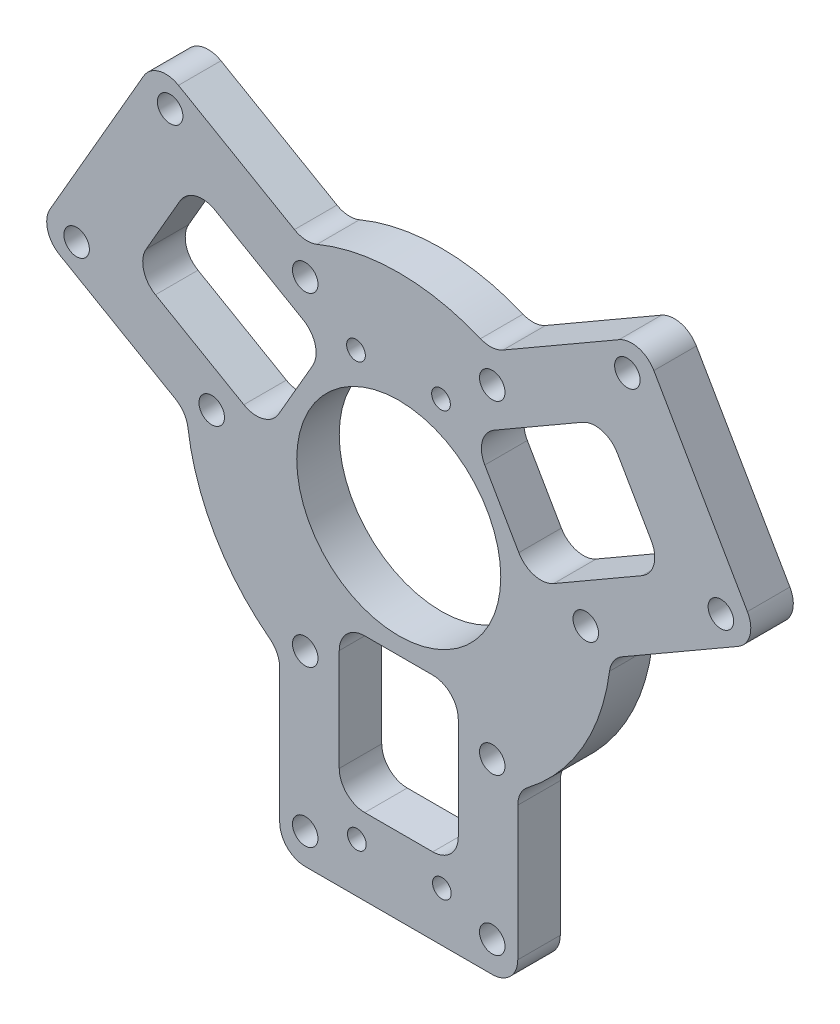
from build123d import *

# Parameters (mm, degrees)
SKETCH1_R           = 25
BOSS_EXTRUDE1_DEPTH = 5
CUT_EXTRUDE1_REACH  = 61.269
SKETCH2_R           = 1.5
FILLET1_R           = 3
CUT_EXTRUDE2_REACH  = 60.487
SKETCH3_R           = 1.1
CUT_EXTRUDE3_REACH  = 60.487
SKETCH4_R           = 1.5
FILLET2_R           = 3
CUT_EXTRUDE4_REACH  = 60.487
SKETCH5_R           = 12
SKETCH5_W           = 14
SKETCH5_H           = 18
FILLET3_R           = 3


with BuildPart() as part:
    # Sketch1 → Boss-Extrude1 (new body)
    with BuildSketch(Plane.XY):
        with BuildLine():
            ThreePointArc((-24.937391115, -1.768198064), (-21.650635095, 12.5), (-10.937391115, 22.480513242))
            Line((-10.937391115, 22.480513242), (-28.507041555, 32.624355653))
            Line((-28.507041555, 32.624355653), (-42.507041555, 8.375644347))
            Line((-42.507041555, 8.375644347), (-24.937391115, -1.768198064))
        make_face()
        Circle(SKETCH1_R)
        with BuildLine():
            Line((28.507041555, 32.624355653), (10.937391115, 22.480513242))
            ThreePointArc((10.937391115, 22.480513242), (21.194749089, 13.258303476), (25, 0))
            ThreePointArc((25, 0), (24.984342876, -0.884653077), (24.937391115, -1.768198064))
            Line((24.937391115, -1.768198064), (42.507041555, 8.375644347))
            Line((42.507041555, 8.375644347), (28.507041555, 32.624355653))
        make_face()
        with BuildLine():
            ThreePointArc((14, -20.712315177), (0, -25), (-14, -20.712315177))
            Line((-14, -20.712315177), (-14, -41))
            Line((-14, -41), (14, -41))
            Line((14, -41), (14, -20.712315177))
        make_face()
    extrude(amount=BOSS_EXTRUDE1_DEPTH)

    # Sketch2 → Cut-Extrude1 (cut, up to next)
    with BuildSketch(Plane.XY.offset(5), mode=Mode.PRIVATE) as cut_extrude1_sk1:
        with Locations((11, -37.4)):
            Circle(SKETCH2_R)
    cut_extrude1_tool1 = extrude(cut_extrude1_sk1.sketch, amount=-CUT_EXTRUDE1_REACH, mode=Mode.PRIVATE) & part.part
    # Sketch2 → Cut-Extrude1 (cut, up to next)
    with BuildSketch(Plane.XY.offset(5), mode=Mode.PRIVATE) as cut_extrude1_sk2:
        with Locations((-11, -37.4)):
            Circle(SKETCH2_R)
    cut_extrude1_tool2 = extrude(cut_extrude1_sk2.sketch, amount=-CUT_EXTRUDE1_REACH, mode=Mode.PRIVATE) & part.part
    # Sketch2 → Cut-Extrude1 (cut, up to next)
    with BuildSketch(Plane.XY.offset(5), mode=Mode.PRIVATE) as cut_extrude1_sk3:
        with Locations((-37.889350102, 9.173720558)):
            Circle(SKETCH2_R)
    cut_extrude1_tool3 = extrude(cut_extrude1_sk3.sketch, amount=-CUT_EXTRUDE1_REACH, mode=Mode.PRIVATE) & part.part
    # Sketch2 → Cut-Extrude1 (cut, up to next)
    with BuildSketch(Plane.XY.offset(5), mode=Mode.PRIVATE) as cut_extrude1_sk4:
        with Locations((-26.889350102, 28.226279442)):
            Circle(SKETCH2_R)
    cut_extrude1_tool4 = extrude(cut_extrude1_sk4.sketch, amount=-CUT_EXTRUDE1_REACH, mode=Mode.PRIVATE) & part.part
    # Sketch2 → Cut-Extrude1 (cut, up to next)
    with BuildSketch(Plane.XY.offset(5), mode=Mode.PRIVATE) as cut_extrude1_sk5:
        with Locations((26.889350102, 28.226279442)):
            Circle(SKETCH2_R)
    cut_extrude1_tool5 = extrude(cut_extrude1_sk5.sketch, amount=-CUT_EXTRUDE1_REACH, mode=Mode.PRIVATE) & part.part
    # Sketch2 → Cut-Extrude1 (cut, up to next)
    with BuildSketch(Plane.XY.offset(5), mode=Mode.PRIVATE) as cut_extrude1_sk6:
        with Locations((37.889350102, 9.173720558)):
            Circle(SKETCH2_R)
    cut_extrude1_tool6 = extrude(cut_extrude1_sk6.sketch, amount=-CUT_EXTRUDE1_REACH, mode=Mode.PRIVATE) & part.part
    add(cut_extrude1_tool1.solids().sort_by_distance((11, -37.4, 5))[0], mode=Mode.SUBTRACT)
    add(cut_extrude1_tool2.solids().sort_by_distance((-11, -37.4, 5))[0], mode=Mode.SUBTRACT)
    add(cut_extrude1_tool3.solids().sort_by_distance((-37.88935, 9.173721, 5))[0], mode=Mode.SUBTRACT)
    add(cut_extrude1_tool4.solids().sort_by_distance((-26.88935, 28.226279, 5))[0], mode=Mode.SUBTRACT)
    add(cut_extrude1_tool5.solids().sort_by_distance((26.88935, 28.226279, 5))[0], mode=Mode.SUBTRACT)
    add(cut_extrude1_tool6.solids().sort_by_distance((37.88935, 9.173721, 5))[0], mode=Mode.SUBTRACT)

    # Fillet1
    fillet1_edges = [part.edges().sort_by_distance(p)[0] for p in [
        (-42.507041555, 8.375644347, 2.5),
        (-28.507041555, 32.624355653, 2.5),
        (28.507041555, 32.624355653, 2.5),
        (42.507041555, 8.375644347, 2.5),
        (14, -41, 2.5),
        (-14, -41, 2.5),
    ]]
    fillet(fillet1_edges, radius=FILLET1_R)

    # Sketch3 → Cut-Extrude2 (cut, up to next)
    with BuildSketch(Plane(origin=(0, 0, 0), x_dir=(-1, 0, 0), z_dir=(0, 0, -1)), mode=Mode.PRIVATE) as cut_extrude2_sk1:
        with Locations((5.030631655, 14.595653448)):
            Circle(SKETCH3_R)
    cut_extrude2_tool1 = extrude(cut_extrude2_sk1.sketch, amount=-CUT_EXTRUDE2_REACH, mode=Mode.PRIVATE) & part.part
    # Sketch3 → Cut-Extrude2 (cut, up to next)
    with BuildSketch(Plane(origin=(0, 0, 0), x_dir=(-1, 0, 0), z_dir=(0, 0, -1)), mode=Mode.PRIVATE) as cut_extrude2_sk2:
        with Locations((-4.969346288, 14.61665653)):
            Circle(SKETCH3_R)
    cut_extrude2_tool2 = extrude(cut_extrude2_sk2.sketch, amount=-CUT_EXTRUDE2_REACH, mode=Mode.PRIVATE) & part.part
    # Sketch3 → Cut-Extrude2 (cut, up to next)
    with BuildSketch(Plane(origin=(0, 0, 0), x_dir=(-1, 0, 0), z_dir=(0, 0, -1)), mode=Mode.PRIVATE) as cut_extrude2_sk3:
        with Locations((4.926079941, -35.183463358)):
            Circle(SKETCH3_R)
    cut_extrude2_tool3 = extrude(cut_extrude2_sk3.sketch, amount=-CUT_EXTRUDE2_REACH, mode=Mode.PRIVATE) & part.part
    # Sketch3 → Cut-Extrude2 (cut, up to next)
    with BuildSketch(Plane(origin=(0, 0, 0), x_dir=(-1, 0, 0), z_dir=(0, 0, -1)), mode=Mode.PRIVATE) as cut_extrude2_sk4:
        with Locations((-5.073898003, -35.162460277)):
            Circle(SKETCH3_R)
    cut_extrude2_tool4 = extrude(cut_extrude2_sk4.sketch, amount=-CUT_EXTRUDE2_REACH, mode=Mode.PRIVATE) & part.part
    add(cut_extrude2_tool1.solids().sort_by_distance((-5.030632, 14.595653, 0))[0], mode=Mode.SUBTRACT)
    add(cut_extrude2_tool2.solids().sort_by_distance((4.969346, 14.616657, 0))[0], mode=Mode.SUBTRACT)
    add(cut_extrude2_tool3.solids().sort_by_distance((-4.92608, -35.183463, 0))[0], mode=Mode.SUBTRACT)
    add(cut_extrude2_tool4.solids().sort_by_distance((5.073898, -35.16246, 0))[0], mode=Mode.SUBTRACT)

    # Sketch4 → Cut-Extrude3 (cut, up to next)
    with BuildSketch(Plane.XY.offset(5), mode=Mode.PRIVATE) as cut_extrude3_sk1:
        with Locations((22, 0)):
            Circle(SKETCH4_R)
    cut_extrude3_tool1 = extrude(cut_extrude3_sk1.sketch, amount=-CUT_EXTRUDE3_REACH, mode=Mode.PRIVATE) & part.part
    # Sketch4 → Cut-Extrude3 (cut, up to next)
    with BuildSketch(Plane.XY.offset(5), mode=Mode.PRIVATE) as cut_extrude3_sk2:
        with Locations((11, -19.052558883)):
            Circle(SKETCH4_R)
    cut_extrude3_tool2 = extrude(cut_extrude3_sk2.sketch, amount=-CUT_EXTRUDE3_REACH, mode=Mode.PRIVATE) & part.part
    # Sketch4 → Cut-Extrude3 (cut, up to next)
    with BuildSketch(Plane.XY.offset(5), mode=Mode.PRIVATE) as cut_extrude3_sk3:
        with Locations((-11, -19.052558883)):
            Circle(SKETCH4_R)
    cut_extrude3_tool3 = extrude(cut_extrude3_sk3.sketch, amount=-CUT_EXTRUDE3_REACH, mode=Mode.PRIVATE) & part.part
    # Sketch4 → Cut-Extrude3 (cut, up to next)
    with BuildSketch(Plane.XY.offset(5), mode=Mode.PRIVATE) as cut_extrude3_sk4:
        with Locations((-22, 0)):
            Circle(SKETCH4_R)
    cut_extrude3_tool4 = extrude(cut_extrude3_sk4.sketch, amount=-CUT_EXTRUDE3_REACH, mode=Mode.PRIVATE) & part.part
    # Sketch4 → Cut-Extrude3 (cut, up to next)
    with BuildSketch(Plane.XY.offset(5), mode=Mode.PRIVATE) as cut_extrude3_sk5:
        with Locations((-11, 19.052558883)):
            Circle(SKETCH4_R)
    cut_extrude3_tool5 = extrude(cut_extrude3_sk5.sketch, amount=-CUT_EXTRUDE3_REACH, mode=Mode.PRIVATE) & part.part
    # Sketch4 → Cut-Extrude3 (cut, up to next)
    with BuildSketch(Plane.XY.offset(5), mode=Mode.PRIVATE) as cut_extrude3_sk6:
        with Locations((11, 19.052558883)):
            Circle(SKETCH4_R)
    cut_extrude3_tool6 = extrude(cut_extrude3_sk6.sketch, amount=-CUT_EXTRUDE3_REACH, mode=Mode.PRIVATE) & part.part
    add(cut_extrude3_tool1.solids().sort_by_distance((22, 0, 5))[0], mode=Mode.SUBTRACT)
    add(cut_extrude3_tool2.solids().sort_by_distance((11, -19.052559, 5))[0], mode=Mode.SUBTRACT)
    add(cut_extrude3_tool3.solids().sort_by_distance((-11, -19.052559, 5))[0], mode=Mode.SUBTRACT)
    add(cut_extrude3_tool4.solids().sort_by_distance((-22, 0, 5))[0], mode=Mode.SUBTRACT)
    add(cut_extrude3_tool5.solids().sort_by_distance((-11, 19.052559, 5))[0], mode=Mode.SUBTRACT)
    add(cut_extrude3_tool6.solids().sort_by_distance((11, 19.052559, 5))[0], mode=Mode.SUBTRACT)

    # Fillet2
    fillet2_edges = [part.edges().sort_by_distance(p)[0] for p in [
        (-10.937391115, 22.480513242, 2.5),
        (10.937391115, 22.480513242, 2.5),
        (24.937391115, -1.768198064, 2.5),
        (14, -20.712315177, 2.5),
        (-14, -20.712315177, 2.5),
        (-24.937391115, -1.768198064, 2.5),
    ]]
    fillet(fillet2_edges, radius=FILLET2_R)

    # Sketch5 → Cut-Extrude4 (cut, up to next)
    with BuildSketch(Plane.XY.offset(5), mode=Mode.PRIVATE) as cut_extrude4_sk1:
        Circle(SKETCH5_R)
    cut_extrude4_tool1 = extrude(cut_extrude4_sk1.sketch, amount=-CUT_EXTRUDE4_REACH, mode=Mode.PRIVATE) & part.part
    # Sketch5 → Cut-Extrude4 (cut, up to next)
    with BuildSketch(Plane.XY.offset(5), mode=Mode.PRIVATE) as cut_extrude4_sk2:
        Polygon((-8.624355653, 13.062177826), (-15.624355653, 0.937822174), (-31.212812921, 9.937822174), (-24.212812921, 22.062177826), align=None)
    cut_extrude4_tool2 = extrude(cut_extrude4_sk2.sketch, amount=-CUT_EXTRUDE4_REACH, mode=Mode.PRIVATE) & part.part
    # Sketch5 → Cut-Extrude4 (cut, up to next)
    with BuildSketch(Plane.XY.offset(5), mode=Mode.PRIVATE) as cut_extrude4_sk3:
        with Locations((0, -23)):
            Rectangle(SKETCH5_W, SKETCH5_H)
    cut_extrude4_tool3 = extrude(cut_extrude4_sk3.sketch, amount=-CUT_EXTRUDE4_REACH, mode=Mode.PRIVATE) & part.part
    # Sketch5 → Cut-Extrude4 (cut, up to next)
    with BuildSketch(Plane.XY.offset(5), mode=Mode.PRIVATE) as cut_extrude4_sk4:
        Polygon((15.624355653, 0.937822174), (8.624355653, 13.062177826), (24.212812921, 22.062177826), (31.212812921, 9.937822174), align=None)
    cut_extrude4_tool4 = extrude(cut_extrude4_sk4.sketch, amount=-CUT_EXTRUDE4_REACH, mode=Mode.PRIVATE) & part.part
    add(cut_extrude4_tool1.solids().sort_by_distance((0, 0, 5))[0], mode=Mode.SUBTRACT)
    add(cut_extrude4_tool2.solids().sort_by_distance((-19.918584, 11.5, 5))[0], mode=Mode.SUBTRACT)
    add(cut_extrude4_tool3.solids().sort_by_distance((0, -23, 5))[0], mode=Mode.SUBTRACT)
    add(cut_extrude4_tool4.solids().sort_by_distance((19.918584, 11.5, 5))[0], mode=Mode.SUBTRACT)

    # Fillet3
    fillet3_edges = [part.edges().sort_by_distance(p)[0] for p in [
        (8.624355653, 13.062177826, 2.5),
        (24.212812921, 22.062177826, 2.5),
        (31.212812921, 9.937822174, 2.5),
        (15.624355653, 0.937822174, 2.5),
        (-15.624355653, 0.937822174, 2.5),
        (-31.212812921, 9.937822174, 2.5),
        (-24.212812921, 22.062177826, 2.5),
        (-8.624355653, 13.062177826, 2.5),
        (7, -14, 2.5),
        (7, -32, 2.5),
        (-7, -32, 2.5),
        (-7, -14, 2.5),
    ]]
    fillet(fillet3_edges, radius=FILLET3_R)


solid = part.part
